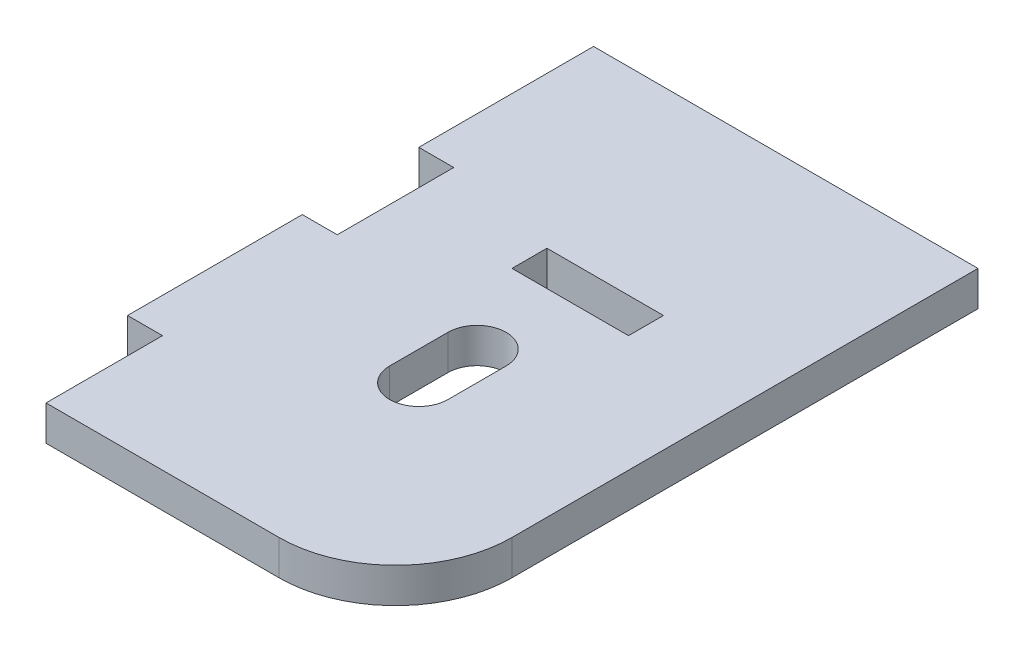
from build123d import *

# Parameters (mm, degrees)
SKETCH1_W           = 10
SKETCH1_H           = 3
BOSS_EXTRUDE1_DEPTH = 3
CUT_EXTRUDE1_DEPTH  = 60.983331018
FILLET1_R           = 10


with BuildPart() as part:
    # Sketch1 → Boss-Extrude1 (new body)
    with BuildSketch(Plane(origin=(0, 0, 0), x_dir=(1, 0, 0), z_dir=(0, 1, 0))):
        Polygon((-33, 0), (-33, -15), (-30, -15), (-30, -25), (-33, -25), (-33, -40), (-30, -40), (-30, -50), (0, -50), (0, 0), align=None)
        with Locations((-15, -18.5)):
            Rectangle(SKETCH1_W, SKETCH1_H, mode=Mode.SUBTRACT)
    extrude(amount=BOSS_EXTRUDE1_DEPTH)

    # Sketch2 → Cut-Extrude1 (cut, through all)
    with BuildSketch(Plane(origin=(0, 3, 0), x_dir=(1, 0, 0), z_dir=(0, 1, 0))):
        with BuildLine():
            Line((-18, -32.5), (-18, -27.5))
            ThreePointArc((-18, -27.5), (-15.5, -25), (-13, -27.5))
            Line((-13, -27.5), (-13, -32.5))
            ThreePointArc((-13, -32.5), (-15.5, -35), (-18, -32.5))
        make_face()
    extrude(amount=-CUT_EXTRUDE1_DEPTH, mode=Mode.SUBTRACT)

    # Fillet1
    fillet1_edges = [part.edges().sort_by_distance(p)[0] for p in [
        (0, 1.5, 50),
    ]]
    fillet(fillet1_edges, radius=FILLET1_R)


solid = part.part
